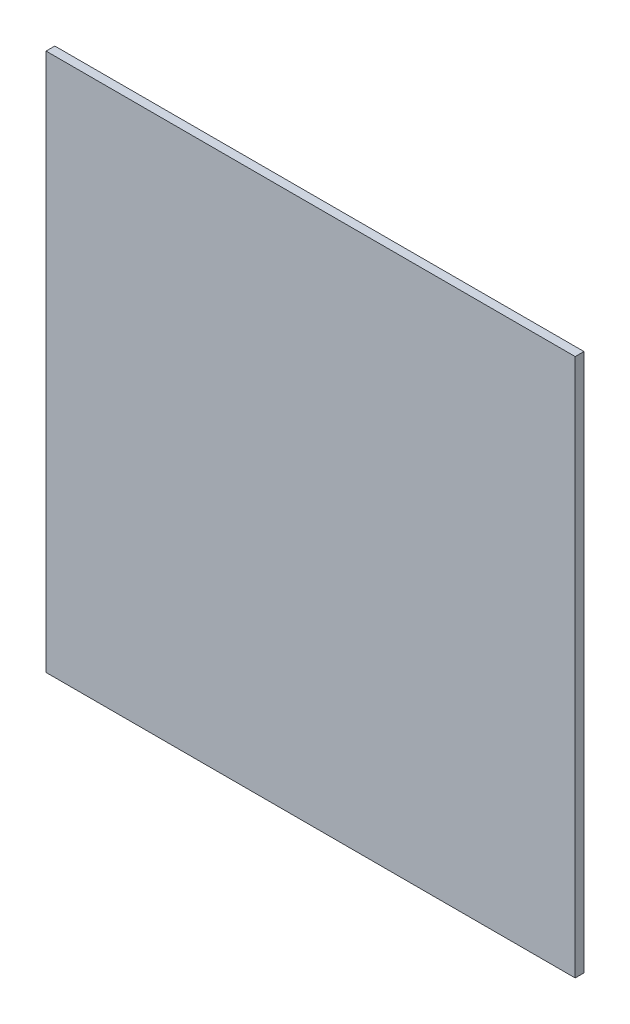
from build123d import *

# Parameters (mm, degrees)
CROQUIS1_W              = 604.7
CROQUIS1_H              = 615
SALIENTE_EXTRUIR1_DEPTH = 10


with BuildPart() as part:
    # Croquis1 → Saliente-Extruir1 (new body)
    with BuildSketch(Plane.XY):
        Rectangle(CROQUIS1_W, CROQUIS1_H)
    extrude(amount=SALIENTE_EXTRUIR1_DEPTH)


solid = part.part
